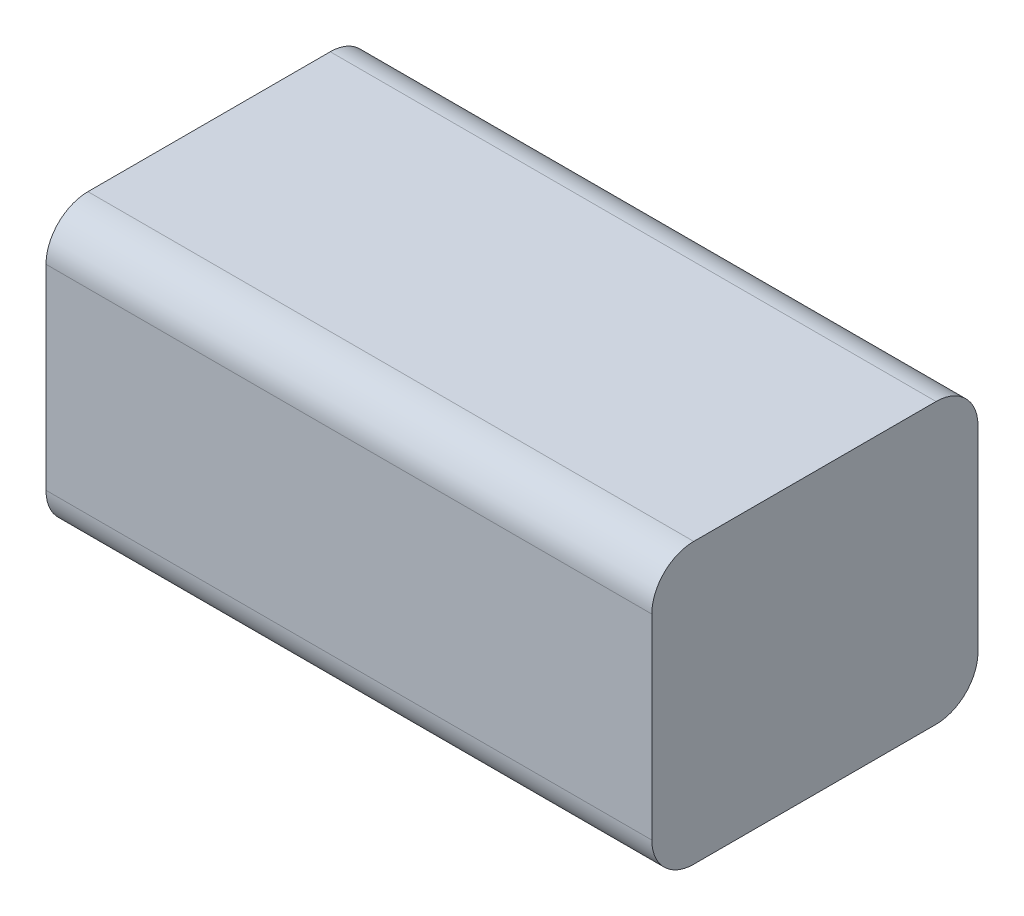
from build123d import *

# Parameters (mm, degrees)
SKETCH1_W           = 65
SKETCH1_H           = 30
BOSS_EXTRUDE2_DEPTH = 35
FILLET2_R           = 4.5


with BuildPart() as part:
    # Sketch1 → Boss-Extrude2 (new body)
    with BuildSketch(Plane.XY):
        with Locations((32.5, 15)):
            Rectangle(SKETCH1_W, SKETCH1_H)
    extrude(amount=BOSS_EXTRUDE2_DEPTH)

    # Fillet2
    fillet2_edges = [part.edges().sort_by_distance(p)[0] for p in [
        (32.5, 30, 35),
        (32.5, 0, 35),
        (32.5, 30, 0),
        (32.5, 0, 0),
    ]]
    fillet(fillet2_edges, radius=FILLET2_R)


solid = part.part
